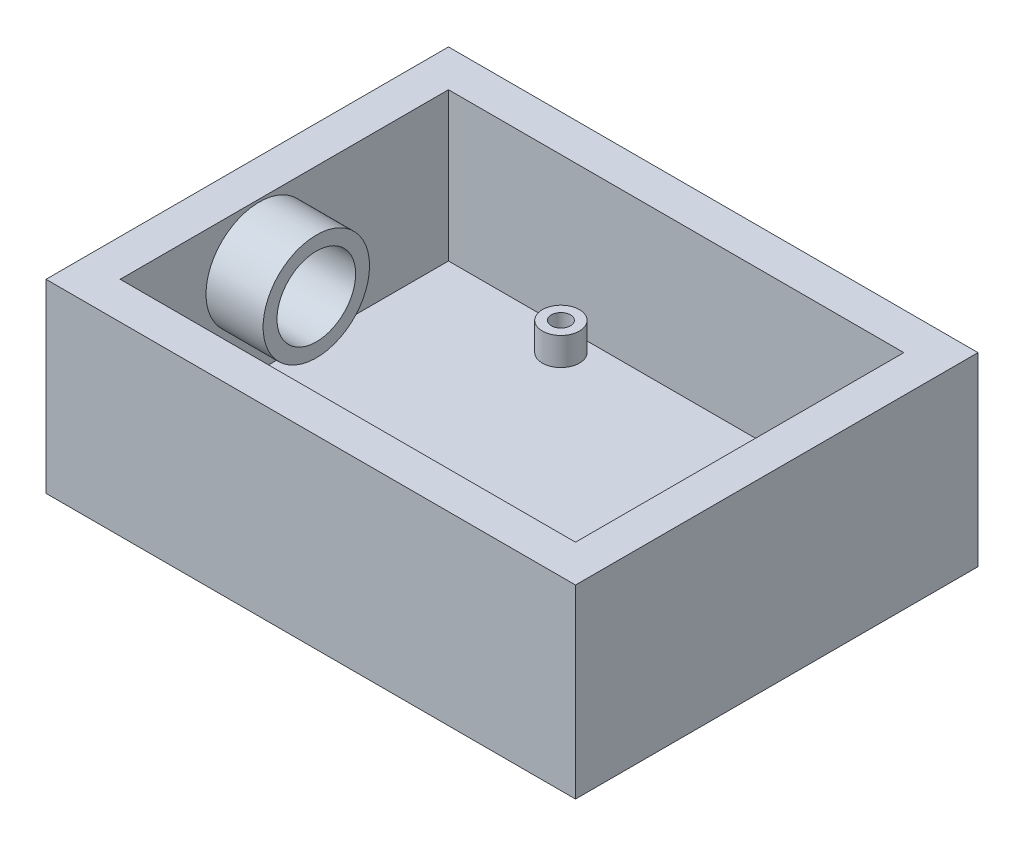
from build123d import *

# Parameters (mm, degrees)
SKETCH2_W                                      = 90.675
SKETCH2_H                                      = 68.925
BOSS_EXTRUDE1_DEPTH                            = 6.35
SKETCH3_R                                      = 3.175
BOSS_EXTRUDE2_DEPTH                            = 4.7625
CSK_FOR_4_FLAT_HEAD_MACHINE_SCREW1_D           = 3.2639
CSK_FOR_4_FLAT_HEAD_MACHINE_SCREW1_CSINK_D     = 5.715
CSK_FOR_4_FLAT_HEAD_MACHINE_SCREW1_CSINK_ANGLE = 82
SKETCH10_W                                     = 90.675
SKETCH10_H                                     = 68.925
SKETCH10_W_2                                   = 77.975
SKETCH10_H_2                                   = 56.225
BOSS_EXTRUDE4_DEPTH                            = 25.4
SKETCH11_R                                     = 9.11225
SKETCH11_R_2                                   = 6.731
BOSS_EXTRUDE5_DEPTH                            = 9.779
CUT_EXTRUDE1_REACH                             = 144.676
SKETCH12_R                                     = 1.5875


with BuildPart() as part:
    # Sketch2 → Boss-Extrude1 (new body)
    with BuildSketch(Plane(origin=(0, 34.361183362, 0), x_dir=(-1, 0, 0), z_dir=(0, -1, 0))):
        with Locations((-20.248501783, -58.074565381)):
            Rectangle(SKETCH2_W, SKETCH2_H)
    extrude(amount=BOSS_EXTRUDE1_DEPTH)

    # Sketch3 → Boss-Extrude2 (add)
    with BuildSketch(Plane(origin=(0, 34.361183362, 0), x_dir=(-1, 0, 0), z_dir=(0, -1, 0))):
        with Locations(Location((-4.448501783, -33.899565381, 0), (0, 0, 90))):
            Circle(SKETCH3_R)
        with Locations(Location((-55.248501783, -49.049565381, 0), (0, 0, 90))):
            Circle(SKETCH3_R)
        with Locations(Location((-55.248501783, -76.999565381, 0), (0, 0, 90))):
            Circle(SKETCH3_R)
        with Locations(Location((-3.048501783, -82.199565381, 0), (0, 0, 90))):
            Circle(SKETCH3_R)
    extrude(amount=-BOSS_EXTRUDE2_DEPTH)

    # CSK for #4 Flat Head Machine Screw1 (through all)
    with Locations(Plane(origin=(0, 28.011183362, 0), x_dir=(-1, 0, 0), z_dir=(0, -1, 0))):
        with Locations((-3.048501783, -82.199565381), (-55.248501783, -76.999565381), (-55.248501783, -49.049565381), (-4.448501783, -33.899565381)):
            CounterSinkHole(CSK_FOR_4_FLAT_HEAD_MACHINE_SCREW1_D / 2, CSK_FOR_4_FLAT_HEAD_MACHINE_SCREW1_CSINK_D / 2, counter_sink_angle=CSK_FOR_4_FLAT_HEAD_MACHINE_SCREW1_CSINK_ANGLE)

    # Sketch10 → Boss-Extrude4 (add)
    with BuildSketch(Plane(origin=(0, 34.361183362, 0), x_dir=(1, 0, 0), z_dir=(0, 1, 0))):
        with Locations((20.248501783, -58.074565381)):
            Rectangle(SKETCH10_W, SKETCH10_H)
        with Locations((20.248501783, -58.074565381)):
            Rectangle(SKETCH10_W_2, SKETCH10_H_2, mode=Mode.SUBTRACT)
    extrude(amount=BOSS_EXTRUDE4_DEPTH)

    # Sketch11 → Boss-Extrude5 (add)
    with BuildSketch(Plane(origin=(-18.738998217, 0, 0), x_dir=(0, 0, -1), z_dir=(1, 0, 0))):
        with Locations((-62.374565381, 50.198683362)):
            Circle(SKETCH11_R)
        with Locations((-62.374565381, 50.198683362)):
            Circle(SKETCH11_R_2, mode=Mode.SUBTRACT)
    extrude(amount=BOSS_EXTRUDE5_DEPTH)

    # Sketch12 → Cut-Extrude1 (cut, up to next)
    with BuildSketch(Plane.ZY.offset(25.088998217), mode=Mode.PRIVATE) as cut_extrude1_sk1:
        with Locations((62.374565381, 50.198683362)):
            Circle(SKETCH12_R)
    cut_extrude1_tool1 = extrude(cut_extrude1_sk1.sketch, amount=-CUT_EXTRUDE1_REACH, mode=Mode.PRIVATE) & part.part
    add(cut_extrude1_tool1.solids().sort_by_distance((-25.088998, 50.198683, 62.374565))[0], mode=Mode.SUBTRACT)


solid = part.part
